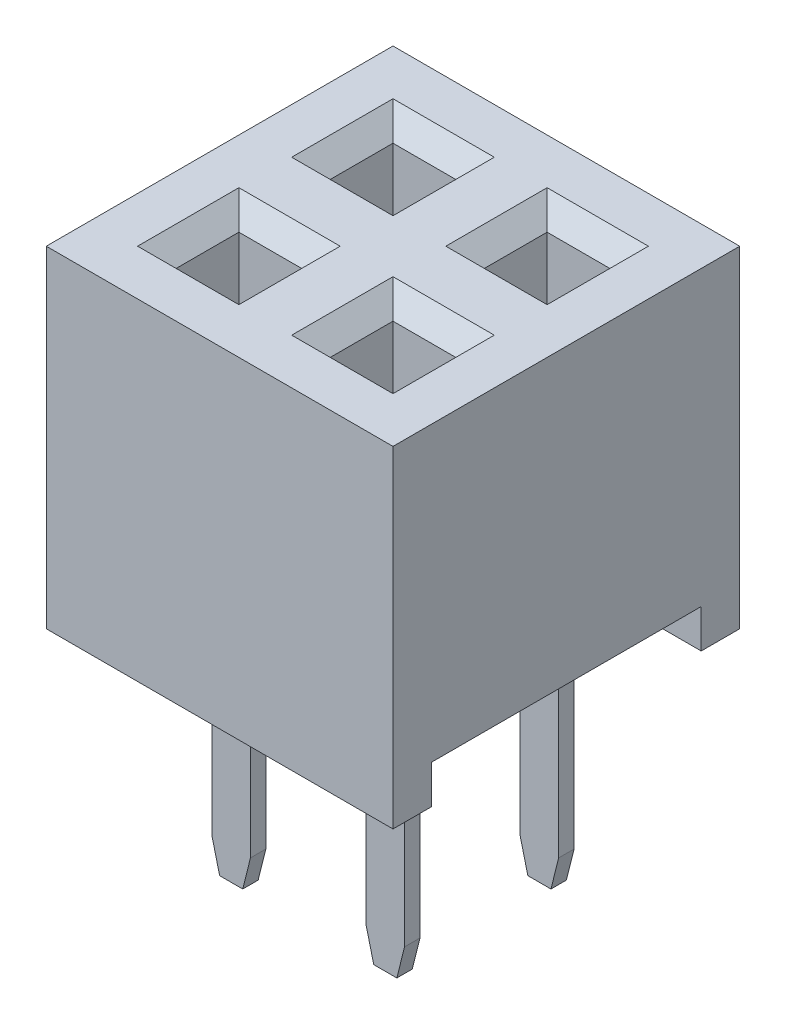
from build123d import *

# Parameters (mm, degrees)
EXTRUDE_1_DEPTH            = 1
SKETCH_3_W                 = 0.814720046
SKETCH_3_H                 = 0.814720046
CUT_EXTRUDE_1_DEPTH        = 3.5
CHAMFER_1_SIZE             = 0.25
CHAMFER_1_OF_MIRROR_1_SIZE = 0.25
EXTRUDE_2_DEPTH            = 0.25
CHAMFER_2_SIZE             = 0.1
CHAMFER_2_SIZE2            = 0.4
CUT_EXTRUDE_2_DEPTH        = 8.514818694
EXTRUDE_4_DEPTH            = 0.25


with BuildPart() as part:
    # 草图1 → 凸台-拉伸1 (new, symmetric)
    with BuildSketch(Plane(origin=(0, 0, 0), x_dir=(0, 0, -1), z_dir=(1, 0, 0))):
        Polygon((-2.25, 0), (2.25, 0), (2.25, -4.3), (1.75, -4.3), (1.75, -3.8), (-1.75, -3.8), (-1.75, -4.3), (-2.25, -4.3), align=None)
    extrude(amount=EXTRUDE_1_DEPTH, both=True)

    # 草图3 → 切除-拉伸1 (cut)
    with BuildSketch(Plane(origin=(0, 0, 0), x_dir=(1, 0, 0), z_dir=(0, 1, 0))):
        with Locations((0, 1)):
            Rectangle(SKETCH_3_W, SKETCH_3_H)
    cut_extrude_1 = extrude(amount=-CUT_EXTRUDE_1_DEPTH, mode=Mode.SUBTRACT)

    # 倒角1
    chamfer_1_edges = [part.edges().sort_by_distance(p)[0] for p in [
        (-0.407360023, 0, -1),
        (0, 0, -0.592639977),
        (0.407360023, 0, -1),
        (0, 0, -1.407360023),
    ]]
    chamfer(chamfer_1_edges, length=CHAMFER_1_SIZE)

    # 镜向1: 切除-拉伸1 across plane
    add(cut_extrude_1.mirror(Plane.XY), mode=Mode.SUBTRACT)

    # 倒角1 of 镜向1
    chamfer_1_of_mirror_1_edges = [part.edges().sort_by_distance(p)[0] for p in [
        (-0.407360023, 0, 1),
        (0, 0, 0.592639977),
        (0.407360023, 0, 1),
        (0, 0, 1.407360023),
    ]]
    chamfer(chamfer_1_of_mirror_1_edges, length=CHAMFER_1_OF_MIRROR_1_SIZE)

    # 草图4 → 凸台-拉伸2 (add)
    with BuildSketch(Plane(origin=(0, 0, 0), x_dir=(0, 0, -1), z_dir=(1, 0, 0))):
        Polygon((1.562968954, -3.8), (1.1, -4.088782437), (1.1, -7.1), (0.9, -7.1), (0.9, -3.977816442), (1.18507098, -3.8), align=None)
    extrude(amount=EXTRUDE_2_DEPTH)

    # 倒角2
    chamfer_2_edges = [part.edges().sort_by_distance(p)[0] for p in [
        (0.25, -7.1, -1),
    ]]
    chamfer_2_side = [part.faces().sort_by_distance(p)[0] for p in [
        (0.125, -7.1, -1),
    ]]
    chamfer(chamfer_2_edges, length=CHAMFER_2_SIZE, length2=CHAMFER_2_SIZE2, reference=chamfer_2_side[0])

    # 草图5 → 切除-拉伸2 (cut, through all)
    with BuildSketch(Plane(origin=(0, 0, 0), x_dir=(1, 0, 0), z_dir=(0, 1, 0))):
        Polygon((0, 2.25), (-1, 2.25), (-1, -2.25), (1, -2.25), (1, 0), (0, 0), align=None)
    extrude(amount=-CUT_EXTRUDE_2_DEPTH, mode=Mode.SUBTRACT)

    # 镜向3: part across plane


with BuildPart() as part_1:
    add(part.part)
    add(part.part.mirror(Plane(origin=(0, 0, 0), x_dir=(0, 0, 1), z_dir=(1, 0, 0))))

    # 镜向4: part across plane


with BuildPart() as part_2:
    add(part_1.part)
    add(part_1.part.mirror(Plane(origin=(0, -7.1, 0), x_dir=(1, 0, 0), z_dir=(0, 0, -1))))

    # 草图6 → 凸台-拉伸4 (add)
    with BuildSketch(Plane(origin=(1, 0, 0), x_dir=(0, 0, -1), z_dir=(1, 0, 0))):
        Polygon((2.25, 0), (-2.25, 0), (-2.25, -4.3), (-1.75, -4.3), (-1.75, -3.8), (1.75, -3.8), (1.75, -4.3), (2.25, -4.3), align=None)
    extrude(amount=EXTRUDE_4_DEPTH)

    # 镜向5: part across face


with BuildPart() as part_3:
    add(part_2.part)
    add(part_2.part.mirror(Plane(origin=(-1, -1.961079545, 0), x_dir=(0, 0, 1), z_dir=(-1, 0, 0))))


solid = part_3.part
